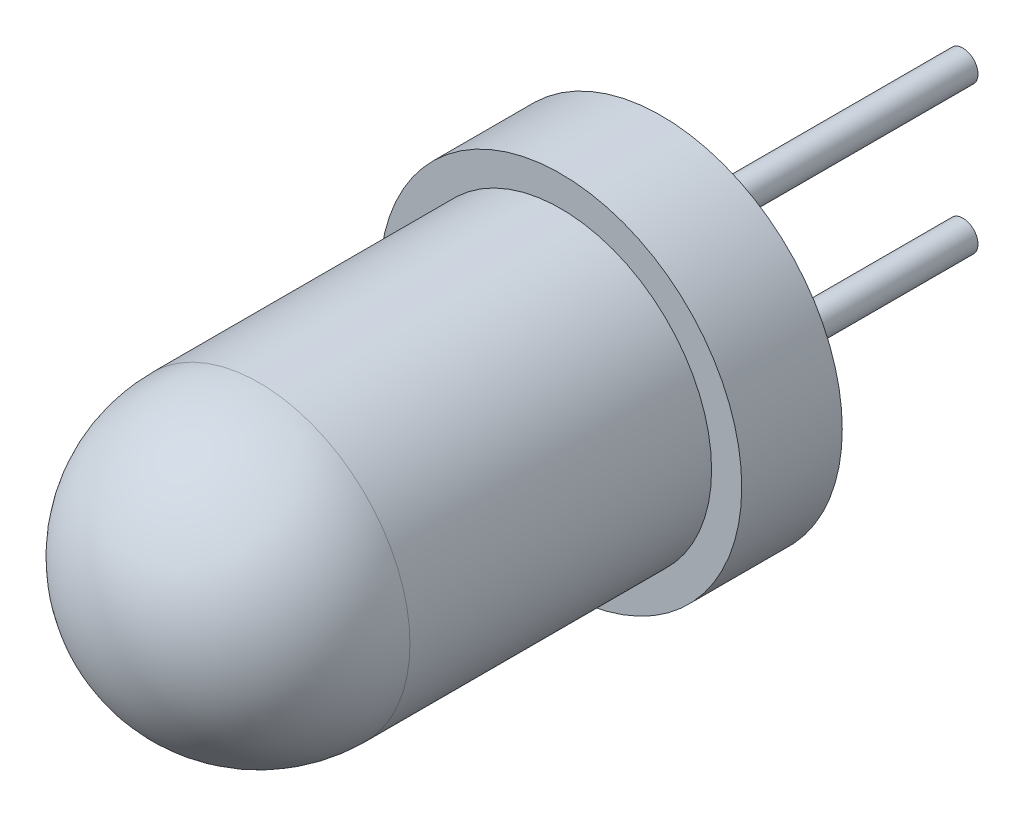
from build123d import *

# Parameters (mm, degrees)
ESQUISSE1_R                  = 1.8
BOSS_EXTRU_1_DEPTH           = 1
ESQUISSE2_R                  = 1.5
BOSS_EXTRU_2_DEPTH           = 3
ESQUISSE4_R                  = 0.14996248625265898
BOSS_EXTRU_3_DEPTH           = 3
R_P_TITION_CIRCULAIRE1_COUNT = 2


with BuildPart() as part:
    # Esquisse1 → Boss.-Extru.1 (new body)
    with BuildSketch(Plane.XY):
        Circle(ESQUISSE1_R)
    extrude(amount=BOSS_EXTRU_1_DEPTH)

    # Esquisse2 → Boss.-Extru.2 (add)
    with BuildSketch(Plane.XY.offset(1)):
        Circle(ESQUISSE2_R)
    extrude(amount=BOSS_EXTRU_2_DEPTH)

    # Esquisse4 → Boss.-Extru.3 (add)
    with BuildSketch(Plane(origin=(0, 0, 0), x_dir=(-1, 0, 0), z_dir=(0, 0, -1))):
        with Locations((0, -0.7324588375787755)):
            Circle(ESQUISSE4_R)
    boss_extru_3 = extrude(amount=BOSS_EXTRU_3_DEPTH)

    # Esquisse3 → Révolution7 (revolve)
    with BuildSketch(Plane(origin=(0, 0, 0), x_dir=(1, 0, 0), z_dir=(0, 1, 0))):
        with BuildLine():
            Line((0, -4), (-1.5000000000000002, -4))
            ThreePointArc((-1.5, -4), (-1.060660171779821, -5.060660171779822), (7e-17, -5.500000000000001))
            Line((0, -5.500000000000001), (0, -4))
        make_face()
    revolve(axis=Axis((0, 0, -0.2750000000000001), (0, 0, 1)))

    # Répétition circulaire1: Boss.-Extru.3 ×2 about axis
    r_p_tition_circulaire1_axis = Axis((0, 0, -0.2750000000000001), (0, 0, 1))
    for i in range(1, R_P_TITION_CIRCULAIRE1_COUNT):
        add(boss_extru_3.rotate(r_p_tition_circulaire1_axis, i * 360 / R_P_TITION_CIRCULAIRE1_COUNT))


solid = part.part
